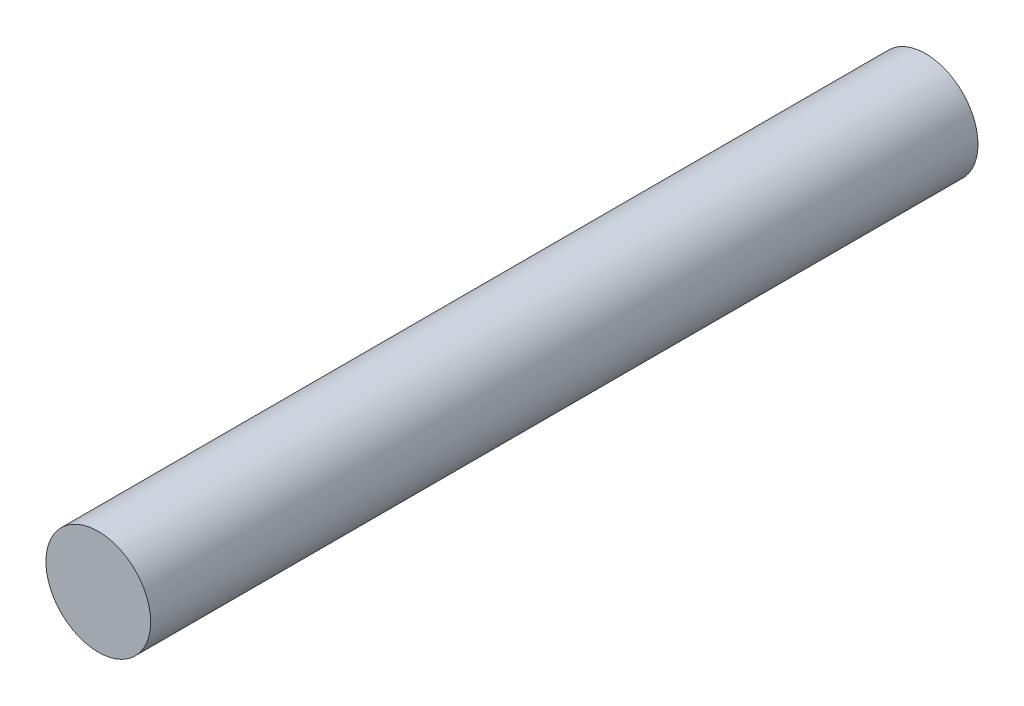
from build123d import *

# Parameters (mm, degrees)
SKETCH1_R           = 1
BOSS_EXTRUDE1_DEPTH = 7.9


with BuildPart() as part:
    # Sketch1 → Boss-Extrude1 (new, symmetric)
    with BuildSketch(Plane.XY):
        with Locations((-0.246030654, 0)):
            Circle(SKETCH1_R)
    extrude(amount=BOSS_EXTRUDE1_DEPTH, both=True)


solid = part.part
